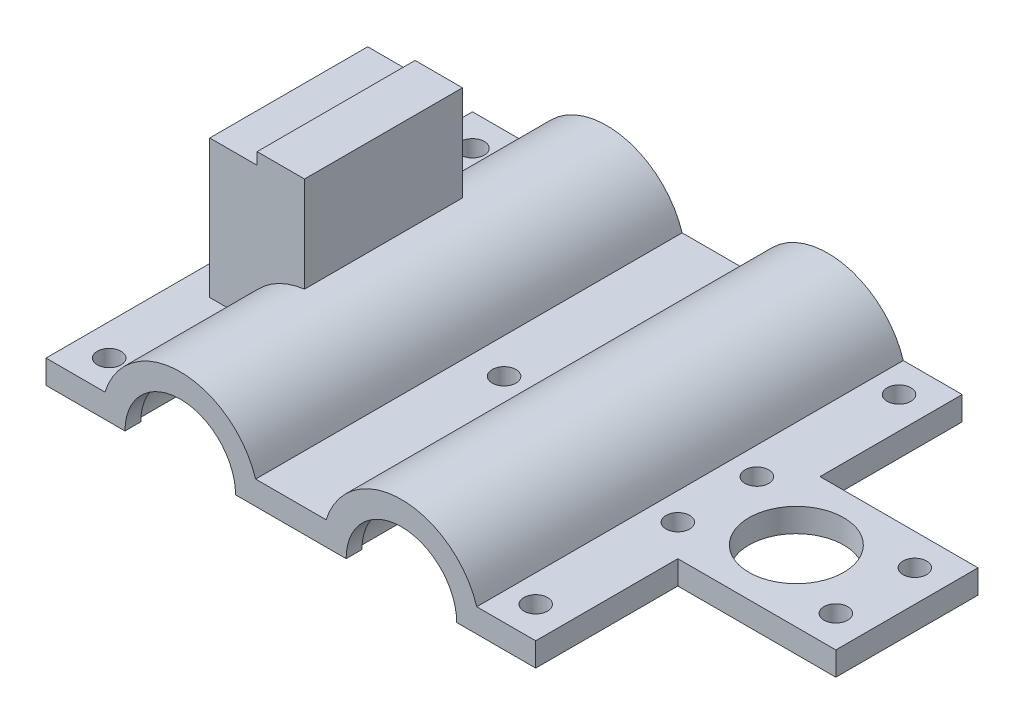
from build123d import *

# Parameters (mm, degrees)
BOSS_EXTRUDE1_DEPTH = 27
BOSS_EXTRUDE2_DEPTH = 2
BOSS_EXTRUDE3_DEPTH = 1
SKETCH4_R           = 1.5
CUT_EXTRUDE1_DEPTH  = 42.701318924
SKETCH5_W           = 27.460607986
SKETCH5_H           = 18
BOSS_EXTRUDE4_DEPTH = 3
SKETCH6_R           = 1.5
SKETCH6_R_2         = 6
CUT_EXTRUDE2_DEPTH  = 59.129166517
BOSS_EXTRUDE5_DEPTH = 10
SKETCH8_W           = 6
SKETCH8_H           = 1.5
BOSS_EXTRUDE6_DEPTH = 20


with BuildPart() as part:
    # Sketch1 → Boss-Extrude1 (new, symmetric)
    with BuildSketch(Plane.XY):
        with BuildLine():
            Line((-31, 3), (-23.539392014, 3))
            ThreePointArc((-23.539392014, 3), (-14, 10), (-4.460607986, 3))
            Line((-4.460607986, 3), (4.460607986, 3))
            ThreePointArc((4.460607986, 3), (14, 10), (23.539392014, 3))
            Line((23.539392014, 3), (31, 3))
            Line((31, 3), (31, 0))
            Line((31, 0), (21.5, 0))
            ThreePointArc((21.5, 0), (14, 7.5), (6.5, 0))
            Line((6.5, 0), (-6.5, 0))
            ThreePointArc((-6.5, 0), (-14, 7.5), (-21.5, 0))
            Line((-21.5, 0), (-31, 0))
            Line((-31, 0), (-31, 3))
        make_face()
    extrude(amount=BOSS_EXTRUDE1_DEPTH, both=True)

    # Sketch2 → Boss-Extrude2 (add)
    with BuildSketch(Plane.XY.offset(27)):
        with BuildLine():
            Line((-22, 0), (-21, 0))
            ThreePointArc((-21, 0), (-14, 7), (-7, 0))
            Line((-7, 0), (-6, 0))
            ThreePointArc((-6, 0), (-14, 8), (-22, 0))
        make_face()
        with BuildLine():
            Line((21, 0), (22, 0))
            ThreePointArc((22, 0), (14, 8), (6, 0))
            Line((6, 0), (7, 0))
            ThreePointArc((7, 0), (14, 7), (21, 0))
        make_face()
    boss_extrude2 = extrude(amount=-BOSS_EXTRUDE2_DEPTH)

    # Mirror1: Boss-Extrude2 across plane
    add(boss_extrude2.mirror(Plane.XY))

    # Sketch3 → Boss-Extrude3 (add, symmetric)
    with BuildSketch(Plane.XY):
        with BuildLine():
            Line((-22, 0), (-21, 0))
            ThreePointArc((-21, 0), (-14, 7), (-7, 0))
            Line((-7, 0), (-6, 0))
            ThreePointArc((-6, 0), (-14, 8), (-22, 0))
        make_face()
        with BuildLine():
            Line((6, 0), (7, 0))
            ThreePointArc((7, 0), (14, 7), (21, 0))
            Line((21, 0), (22, 0))
            ThreePointArc((22, 0), (14, 8), (6, 0))
        make_face()
    extrude(amount=BOSS_EXTRUDE3_DEPTH, both=True)

    # Sketch4 → Cut-Extrude1 (cut, through all)
    with BuildSketch(Plane(origin=(0, 3, 0), x_dir=(1, 0, 0), z_dir=(0, 1, 0))):
        with Locations(Location((-27, 23, 0), (0, 0, 270))):
            Circle(SKETCH4_R)
        with Locations(Location((-27, -23, 0), (0, 0, 270))):
            Circle(SKETCH4_R)
        with Locations(Location((27, -23, 0), (0, 0, 270))):
            Circle(SKETCH4_R)
        with Locations(Location((27, 23, 0), (0, 0, 270))):
            Circle(SKETCH4_R)
        with Locations(Location((0, 0, 0), (0, 0, 270))):
            Circle(SKETCH4_R)
    extrude(amount=-CUT_EXTRUDE1_DEPTH, mode=Mode.SUBTRACT)

    # Sketch5 → Boss-Extrude4 (add)
    with BuildSketch(Plane(origin=(0, 3, 0), x_dir=(1, 0, 0), z_dir=(0, 1, 0))):
        with Locations((37.269696007, 0)):
            Rectangle(SKETCH5_W, SKETCH5_H)
    extrude(amount=-BOSS_EXTRUDE4_DEPTH)

    # Sketch6 → Cut-Extrude2 (cut, through all)
    with BuildSketch(Plane(origin=(0, 3, 0), x_dir=(1, 0, 0), z_dir=(0, 1, 0))):
        with Locations(Location((47, 5, 0), (0, 0, 270))):
            Circle(SKETCH6_R)
        with Locations(Location((47, -5, 0), (0, 0, 270))):
            Circle(SKETCH6_R)
        with Locations(Location((27, -5, 0), (0, 0, 270))):
            Circle(SKETCH6_R)
        with Locations(Location((27, 5, 0), (0, 0, 270))):
            Circle(SKETCH6_R)
        with Locations(Location((37, 0, 0), (0, 0, 270))):
            Circle(SKETCH6_R_2)
    extrude(amount=-CUT_EXTRUDE2_DEPTH, mode=Mode.SUBTRACT)

    # Sketch7 → Boss-Extrude5 (add, symmetric)
    with BuildSketch(Plane.XY):
        with BuildLine():
            Line((-27.269696007, 3), (-23.539392014, 3))
            ThreePointArc((-23.539392014, 3), (-20.416966951, 7.669585071), (-15.269696007, 9.919066088))
            Line((-15.269696007, 9.919066088), (-15.269696007, 20.5))
            Line((-15.269696007, 20.5), (-27.269696007, 20.5))
            Line((-27.269696007, 20.5), (-27.269696007, 3))
        make_face()
    extrude(amount=BOSS_EXTRUDE5_DEPTH, both=True)

    # Sketch8 → Boss-Extrude6 (add)
    with BuildSketch(Plane(origin=(0, 0, -10), x_dir=(-1, 0, 0), z_dir=(0, 0, -1))):
        with Locations((18.269696007, 21.25)):
            Rectangle(SKETCH8_W, SKETCH8_H)
    extrude(amount=-BOSS_EXTRUDE6_DEPTH)


solid = part.part
